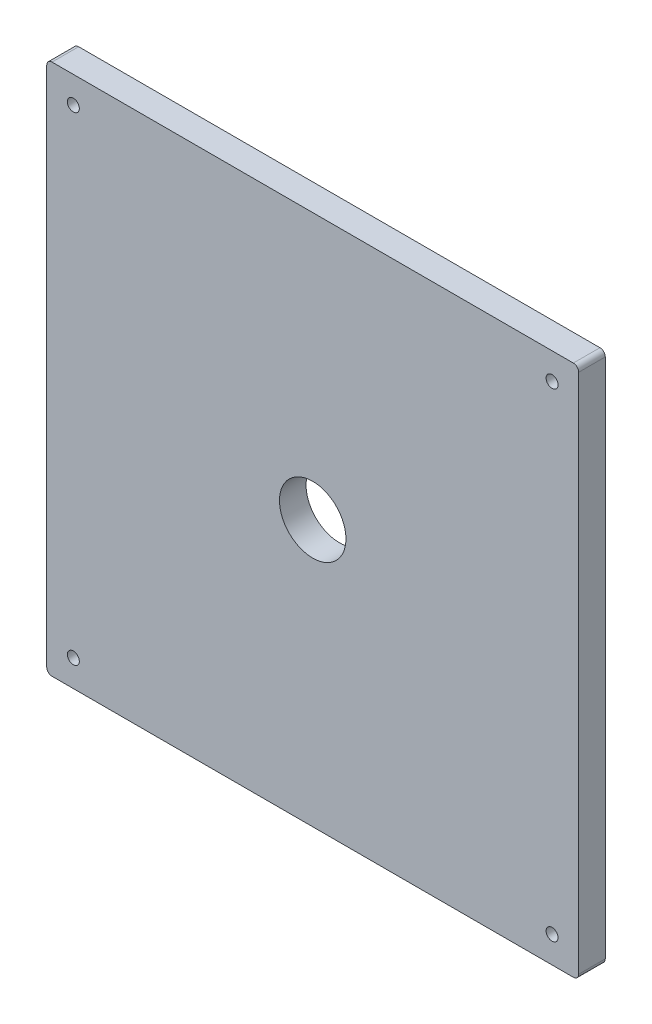
from build123d import *

# Parameters (mm, degrees)
ESQUISSE1_R                                = 12.5
BOSS_EXTRU_1_DEPTH                         = 10
D_GAGEMENT_M41_D                           = 4.5
CHAMBRAGE_POUR_VIS_T_TE_RONDE_BOMB_2_COUNT = 2
CHAMBRAGE_POUR_VIS_T_TE_RONDE_BOMB_2_PITCH = 180
CHAMBRAGE_POUR_VIS_T_TE_RONDE_BOMB_3_COUNT = 2
CHAMBRAGE_POUR_VIS_T_TE_RONDE_BOMB_3_PITCH = 254.558441227
CHAMBRAGE_POUR_VIS_T_TE_RONDE_BOMB_4_COUNT = 2
CHAMBRAGE_POUR_VIS_T_TE_RONDE_BOMB_4_PITCH = 180


with BuildPart() as part:
    # Esquisse1 → Boss.-Extru.1 (new body)
    with BuildSketch(Plane.XY):
        with BuildLine():
            Line((-98, -100), (98, -100))
            ThreePointArc((98, -100), (99.414213562, -99.414213562), (100, -98))
            Line((100, -98), (100, 98))
            ThreePointArc((100, 98), (99.414213562, 99.414213562), (98, 100))
            Line((98, 100), (-98, 100))
            ThreePointArc((-98, 100), (-99.414213562, 99.414213562), (-100, 98))
            Line((-100, 98), (-100, -98))
            ThreePointArc((-100, -98), (-99.414213562, -99.414213562), (-98, -100))
        make_face()
        Circle(ESQUISSE1_R, mode=Mode.SUBTRACT)
    extrude(amount=BOSS_EXTRU_1_DEPTH)

    # Dégagement M41 (through all)
    with Locations(Plane.XY.offset(10)):
        with Locations((-90, 90), (-90, -90), (90, -90), (90, 90)):
            Hole(D_GAGEMENT_M41_D / 2)

    # Esquisse6 → Chambrage pour vis à tête ronde bombée M41 (revolve, cut)
    with BuildSketch(Plane(origin=(90, 90, 0), x_dir=(0, 1, 0), z_dir=(1, 0, 0))):
        Polygon((0, 0), (0, 10), (2.25, 10), (2.25, 3.125), (2.275, 3.1), (4.5, 3.1), (4.5, 0), align=None)
    chambrage_pour_vis_t_te_ronde_bomb_e_m = revolve(axis=Axis((90, 90, -6.35), (0, 0, 1)), mode=Mode.SUBTRACT)

    # Chambrage pour vis _ t_te ronde bomb 2: Chambrage pour vis à tête ronde bombée M41 ×2
    with Locations(*[(-i * CHAMBRAGE_POUR_VIS_T_TE_RONDE_BOMB_2_PITCH, 0, 0) for i in range(1, CHAMBRAGE_POUR_VIS_T_TE_RONDE_BOMB_2_COUNT)]):
        add(chambrage_pour_vis_t_te_ronde_bomb_e_m, mode=Mode.SUBTRACT)

    # Chambrage pour vis _ t_te ronde bomb 3: Chambrage pour vis à tête ronde bombée M41 ×2
    with Locations(*[Vector(-0.7071067811865476, -0.7071067811865476, 0) * (i * CHAMBRAGE_POUR_VIS_T_TE_RONDE_BOMB_3_PITCH) for i in range(1, CHAMBRAGE_POUR_VIS_T_TE_RONDE_BOMB_3_COUNT)]):
        add(chambrage_pour_vis_t_te_ronde_bomb_e_m, mode=Mode.SUBTRACT)

    # Chambrage pour vis _ t_te ronde bomb 4: Chambrage pour vis à tête ronde bombée M41 ×2
    with Locations(*[(0, -i * CHAMBRAGE_POUR_VIS_T_TE_RONDE_BOMB_4_PITCH, 0) for i in range(1, CHAMBRAGE_POUR_VIS_T_TE_RONDE_BOMB_4_COUNT)]):
        add(chambrage_pour_vis_t_te_ronde_bomb_e_m, mode=Mode.SUBTRACT)


solid = part.part
